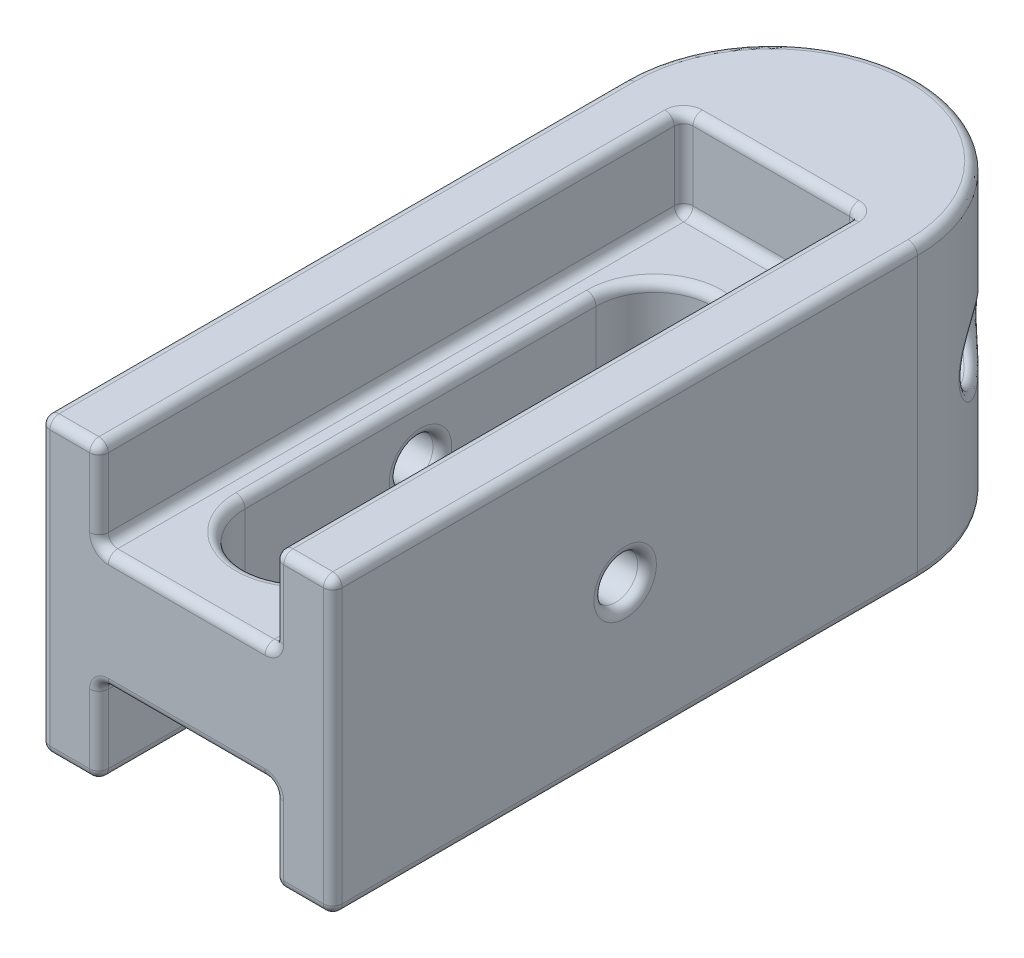
from build123d import *

# Parameters (mm, degrees)
SKETCH1_W                = 15.875
SKETCH1_H                = 15.875
BOSS_EXTRUDE1_DEPTH      = 31.75
BOSS_EXTRUDE3_DEPTH      = 3.175
BOSS_EXTRUDE3_DEPTH_BACK = 3.175
SKETCH4_R                = 1.190625
CUT_EXTRUDE1_DEPTH       = 37.374194579
SKETCH8_R                = 1.5875
CUT_EXTRUDE3_DEPTH       = 7.9375
SKETCH7_R                = 1.5875
CUT_EXTRUDE4_DEPTH       = 7.9375
SKETCH9_W                = 9.525
SKETCH9_H                = 4.7625
CUT_EXTRUDE5_DEPTH       = 34.675960478
CUT_EXTRUDE6_DEPTH       = 35.562321451
FILLET1_R                = 0.508
FILLET14_R               = 0.508
BOSS_EXTRUDE14_DEPTH     = 4.7625
FILLET15_R               = 0.508
BOSS_EXTRUDE15_DEPTH     = 2.54


with BuildPart() as part:
    # Sketch1 → Boss-Extrude1 (new body)
    with BuildSketch(Plane.XY):
        Rectangle(SKETCH1_W, SKETCH1_H)
    extrude(amount=BOSS_EXTRUDE1_DEPTH)

    # Sketch3 → Boss-Extrude3 (add, two sides: drawn at the far end of the back side and taken through both)
    with BuildSketch(Plane(origin=(0, 0, 0), x_dir=(1, 0, 0), z_dir=(0, 1, 0)).offset(-BOSS_EXTRUDE3_DEPTH_BACK)):
        with BuildLine():
            Line((-7.9375, 0), (7.9375, 0))
            ThreePointArc((7.9375, 0), (0, 7.9375), (-7.9375, 0))
        make_face()
    extrude(amount=BOSS_EXTRUDE3_DEPTH + BOSS_EXTRUDE3_DEPTH_BACK)

    # Sketch4 → Cut-Extrude1 (cut, through all)
    with BuildSketch(Plane(origin=(7.9375, 0, 0), x_dir=(0, 0, -1), z_dir=(1, 0, 0))):
        with Locations((-15.875, 0)):
            Circle(SKETCH4_R)
    extrude(amount=-CUT_EXTRUDE1_DEPTH, mode=Mode.SUBTRACT)

    # Sketch8 → Cut-Extrude3 (cut)
    with BuildSketch(Plane(origin=(6.380613831, 0, -4.72140587), x_dir=(-0.5948227867513453, 0, -0.8038568606172144), z_dir=(0.8038568606172144, 0, -0.5948227867513453))):
        Circle(SKETCH8_R)
    extrude(amount=-CUT_EXTRUDE3_DEPTH, mode=Mode.SUBTRACT)

    # Sketch7 → Cut-Extrude4 (cut)
    with BuildSketch(Plane(origin=(-4.72140587, 0, -6.380613831), x_dir=(0.8038568606172144, 0, -0.5948227867513454), z_dir=(0.5948227867513453, 0, 0.8038568606172143))):
        with Locations(Location((0, 0, 0), (0, 0, 180))):
            Circle(SKETCH7_R)
    extrude(amount=CUT_EXTRUDE4_DEPTH, mode=Mode.SUBTRACT)

    # Sketch9 → Cut-Extrude5 (cut, through all)
    with BuildSketch(Plane(origin=(0, 0, 0), x_dir=(-1, 0, 0), z_dir=(0, 0, -1))):
        with Locations((0, 5.55625)):
            Rectangle(SKETCH9_W, SKETCH9_H)
        with Locations((0, -5.55625)):
            Rectangle(SKETCH9_W, SKETCH9_H)
    extrude(amount=-CUT_EXTRUDE5_DEPTH, mode=Mode.SUBTRACT)

    # Sketch10 → Cut-Extrude6 (cut, through all)
    with BuildSketch(Plane(origin=(0, -3.175, 0), x_dir=(-1, 0, 0), z_dir=(0, -1, 0))):
        with BuildLine():
            Line((-3.175, -25.4), (-3.175, -6.35))
            ThreePointArc((-3.175, -6.35), (0, -3.175), (3.175, -6.35))
            Line((3.175, -6.35), (3.175, -25.4))
            ThreePointArc((3.175, -25.4), (0, -28.575), (-3.175, -25.4))
        make_face()
    extrude(amount=-CUT_EXTRUDE6_DEPTH, mode=Mode.SUBTRACT)

    # Fillet1
    fillet1_edges = [part.edges().sort_by_distance(p)[0] for p in [
        (7.195980431, 4e-09, -3.34989133),
        (-3.34989133, -4e-09, -7.195980431),
    ]]
    fillet(fillet1_edges, radius=FILLET1_R)

    # Fillet14
    fillet14_edges = [part.edges().sort_by_distance(p)[0] for p in [
        (-7.9375, 0, 17.065625),
        (7.9375, 0, 17.065625),
        (3.175, 0, 17.065625),
        (-3.175, 0, 17.065625),
    ]]
    fillet(fillet14_edges, radius=FILLET14_R)

    # Sketch13 → Boss-Extrude14 (add)
    with BuildSketch(Plane(origin=(0, 3.175, 0), x_dir=(1, 0, 0), z_dir=(0, 1, 0))):
        with BuildLine():
            Line((-7.9375, 0), (7.9375, 0))
            ThreePointArc((7.9375, 0), (0, 7.9375), (-7.9375, 0))
        make_face()
    boss_extrude14 = extrude(amount=BOSS_EXTRUDE14_DEPTH)

    # Mirror1: Boss-Extrude14 across plane
    add(boss_extrude14.mirror(Plane.ZX))

    # Fillet15
    fillet15_edges = [part.edges().sort_by_distance(p)[0] for p in [
        (-7.9375, 0, 31.75),
        (0, 3.175, 0),
        (0, 7.9375, -7.9375),
        (0, 7.9375, 0),
        (-6.35, -7.9375, 31.75),
        (0, -7.9375, 0),
        (0, -7.9375, -7.9375),
        (0, -3.175, 0),
        (7.9375, 0, 31.75),
        (-6.35, 7.9375, 31.75),
        (4.7625, 5.55625, 31.75),
        (4.7625, 3.175, 15.875),
        (4.7625, 7.9375, 15.875),
        (-4.7625, 5.55625, 31.75),
        (-4.7625, 7.9375, 15.875),
        (0, 3.175, 31.75),
        (-4.7625, 3.175, 15.875),
        (4.7625, 5.55625, 0),
        (-4.7625, 5.55625, 0),
        (6.35, -7.9375, 31.75),
        (4.7625, -5.55625, 31.75),
        (4.7625, -7.9375, 15.875),
        (0, -3.175, 31.75),
        (4.7625, -3.175, 15.875),
        (-4.7625, -5.55625, 31.75),
        (-4.7625, -3.175, 15.875),
        (-4.7625, -7.9375, 15.875),
        (4.7625, -5.55625, 0),
        (-4.7625, -5.55625, 0),
        (6.35, 7.9375, 31.75),
        (7.9375, -7.9375, 15.875),
        (-7.9375, -7.9375, 15.875),
        (-7.9375, 7.9375, 15.875),
        (7.9375, 7.9375, 15.875),
        (0, 3.175, 3.175),
        (0, 3.175, 28.575),
        (3.175, 3.175, 15.875),
        (-3.175, 3.175, 15.875),
        (0, -3.175, 28.575),
        (-3.175, -3.175, 15.875),
        (0, -3.175, 3.175),
        (3.175, -3.175, 15.875),
    ]]
    fillet(fillet15_edges, radius=FILLET15_R)

    # Sketch14 → Boss-Extrude15 (add, symmetric)
    with BuildSketch(Plane(origin=(0, 0, 0), x_dir=(1, 0, 0), z_dir=(0, 1, 0))):
        Polygon((0.332639056, 2.225283), (-2.467850734, 0.153029565), (-0.298336706, -2.778900373), (2.502153084, -0.706646937), align=None)
    extrude(amount=BOSS_EXTRUDE15_DEPTH, both=True)


solid = part.part
